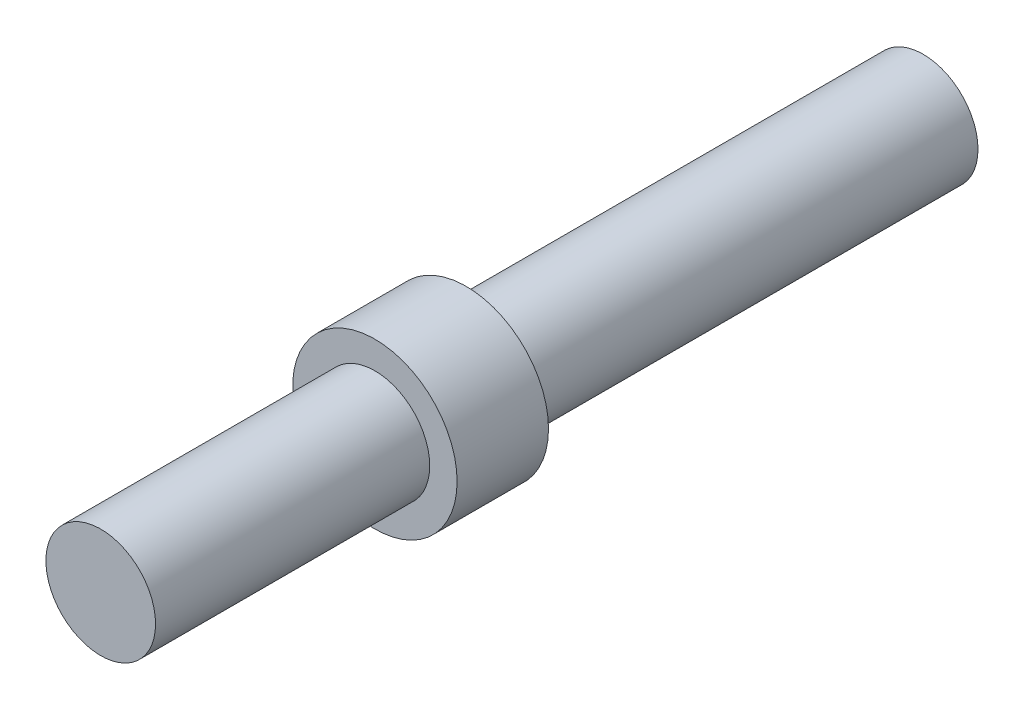
from build123d import *

# Parameters (mm, degrees)
SKETCH2_R           = 6
BOSS_EXTRUDE1_DEPTH = 50
SKETCH3_R           = 9
BOSS_EXTRUDE2_DEPTH = 10
SKETCH4_R           = 6
BOSS_EXTRUDE3_DEPTH = 30


with BuildPart() as part:
    # Sketch2 → Boss-Extrude1 (new body)
    with BuildSketch(Plane.XY):
        Circle(SKETCH2_R)
    extrude(amount=BOSS_EXTRUDE1_DEPTH)

    # Sketch3 → Boss-Extrude2 (add)
    with BuildSketch(Plane.XY.offset(50)):
        Circle(SKETCH3_R)
    extrude(amount=BOSS_EXTRUDE2_DEPTH)

    # Sketch4 → Boss-Extrude3 (add)
    with BuildSketch(Plane.XY.offset(60)):
        Circle(SKETCH4_R)
    extrude(amount=BOSS_EXTRUDE3_DEPTH)


solid = part.part
